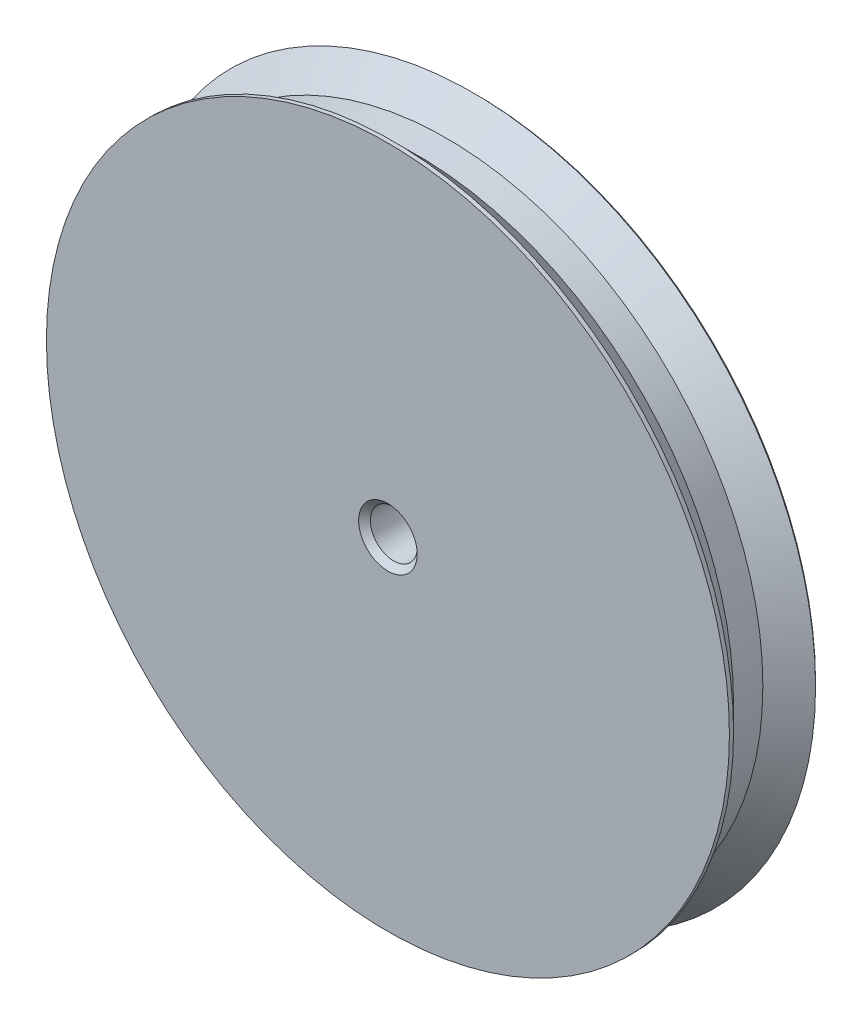
from build123d import *
from OCP.BRepFilletAPI import BRepFilletAPI_MakeChamfer

# Parameters (mm, degrees)
CHAMFER1_SIZE  = 1
CHAMFER1_SIZE2 = 0.707106781


with BuildPart() as part:
    # Sketch1 → Revolve1 (revolve)
    with BuildSketch(Plane(origin=(0, 0, 0), x_dir=(1, 0, 0), z_dir=(0, 1, 0))):
        Polygon((59, 0), (54, 5), (54, 10), (59, 15), (4, 15), (4, 0), align=None)
    revolve(axis=Axis((0, 0, 0), (0, 0, -1)))

    # Chamfer1: one chamfer whose edges measure the first distance from different faces: ONE call of the kernel's chamfer builder (chamfer() names one face for all edges)
    chamfer1_edges_1 = [part.edges().sort_by_distance(p)[0] for p in [
        (-4, 0, 0),
        (-4, 0, -15),
    ]]
    chamfer1_edges_2 = [part.edges().sort_by_distance(p)[0] for p in [
        (-59, 0, 0),
    ]]
    chamfer1_side_2 = [part.faces().sort_by_distance(p)[0] for p in [
        (-56.5, 0, -2.5),
    ]]
    chamfer1_edges_3 = [part.edges().sort_by_distance(p)[0] for p in [
        (-59, 0, -15),
    ]]
    chamfer1_side_3 = [part.faces().sort_by_distance(p)[0] for p in [
        (-57.331227996, 0, -15),
    ]]
    chamfer1 = BRepFilletAPI_MakeChamfer(part.part.solid().wrapped)
    for e in chamfer1_edges_1:
        chamfer1.Add(CHAMFER1_SIZE, e.wrapped)
    for e in chamfer1_edges_2:
        chamfer1.Add(CHAMFER1_SIZE, CHAMFER1_SIZE2, e.wrapped, chamfer1_side_2[0].wrapped)  # the first distance lies on this face
    for e in chamfer1_edges_3:
        chamfer1.Add(CHAMFER1_SIZE, CHAMFER1_SIZE2, e.wrapped, chamfer1_side_3[0].wrapped)  # the first distance lies on this face
    add(Compound.cast(chamfer1.Shape()), mode=Mode.REPLACE)


solid = part.part
